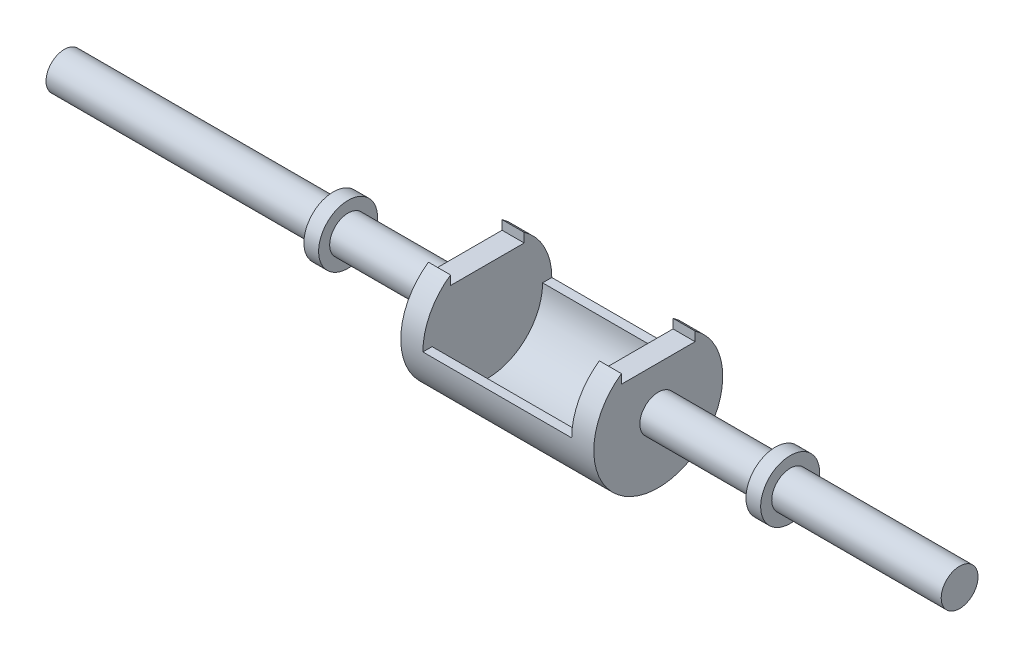
from build123d import *

# Parameters (mm, degrees)
CUT_EXTRUDE1_DEPTH       = 138.249772313
CUT_EXTRUDE1_DEPTH_BACK  = 138.249772313
SKETCH3_W                = 40.4
SKETCH3_H                = 18
CUT_EXTRUDE2_REACH       = 138.463
BOSS_EXTRUDE1_DEPTH      = 2
BOSS_EXTRUDE1_DEPTH_BACK = 2
SKETCH5_R                = 8
BOSS_EXTRUDE2_DEPTH      = 2
BOSS_EXTRUDE2_DEPTH_BACK = 2
SKETCH6_R                = 8


with BuildPart() as part:
    # Sketch1 → Revolve2 (revolve)
    with BuildSketch(Plane.XY, mode=Mode.PRIVATE) as revolve2_sk:
        Polygon((-135, 5), (-26.2, 5), (-26.2, 17.5), (26.2, 17.5), (26.2, 5), (108, 5), (108, 0), (20.2, 0), (20.2, 15), (-20.2, 15), (-20.2, 0), (-135, 0), align=None)
    revolve(revolve2_sk.sketch.rotate(Axis((-109.707215801, 0, 0), (1, 0, 0)), 90), axis=Axis((-109.707215801, 0, 0), (1, 0, 0)))

    # Sketch3 → Cut-Extrude1 (cut, two sides: drawn at the far end of the back side and taken through both)
    with BuildSketch(Plane.XY.offset(-CUT_EXTRUDE1_DEPTH_BACK)):
        with Locations((0, 9)):
            Rectangle(SKETCH3_W, SKETCH3_H)
    extrude(amount=CUT_EXTRUDE1_DEPTH + CUT_EXTRUDE1_DEPTH_BACK, mode=Mode.SUBTRACT)

    # Cut-Extrude2: up to this face of the body (flat: up to its plane)
    cut_extrude2_end = Plane(part.part.faces().sort_by_distance((26.2, 0, -17.005025253))[0])
    # Sketch4 → Cut-Extrude2 (cut, up to the picked face)
    with BuildSketch(Plane.ZY.offset(26.2), mode=Mode.PRIVATE) as cut_extrude2_sk1:
        with BuildLine():
            Line((-10, 14.361406616), (-10, 11.861406616))
            Line((-10, 11.861406616), (10, 11.861406616))
            Line((10, 11.861406616), (10, 14.361406616))
            ThreePointArc((10, 14.361406616), (0, 17.5), (-10, 14.361406616))
        make_face()
    cut_extrude2_tool1 = split(extrude(cut_extrude2_sk1.sketch, amount=-CUT_EXTRUDE2_REACH, mode=Mode.PRIVATE), bisect_by=cut_extrude2_end, keep=Keep.BOTH, mode=Mode.PRIVATE)
    add(cut_extrude2_tool1.solids().sort_by(Axis((-26.2, 14.269595, 0), (1, 0, 0)))[0], mode=Mode.SUBTRACT)

    # Sketch5 → Boss-Extrude1 (add, two sides: drawn at the far end of the back side and taken through both)
    with BuildSketch(Plane(origin=(60, 0, 0), x_dir=(0, 0, -1), z_dir=(1, 0, 0)).offset(-BOSS_EXTRUDE1_DEPTH_BACK)):
        Circle(SKETCH5_R)
    extrude(amount=BOSS_EXTRUDE1_DEPTH + BOSS_EXTRUDE1_DEPTH_BACK)

    # Sketch6 → Boss-Extrude2 (add, two sides: drawn at the far end of the back side and taken through both)
    with BuildSketch(Plane(origin=(-60, 0, 0), x_dir=(0, 0, -1), z_dir=(1, 0, 0)).offset(-BOSS_EXTRUDE2_DEPTH_BACK)):
        Circle(SKETCH6_R)
    extrude(amount=BOSS_EXTRUDE2_DEPTH + BOSS_EXTRUDE2_DEPTH_BACK)


solid = part.part
